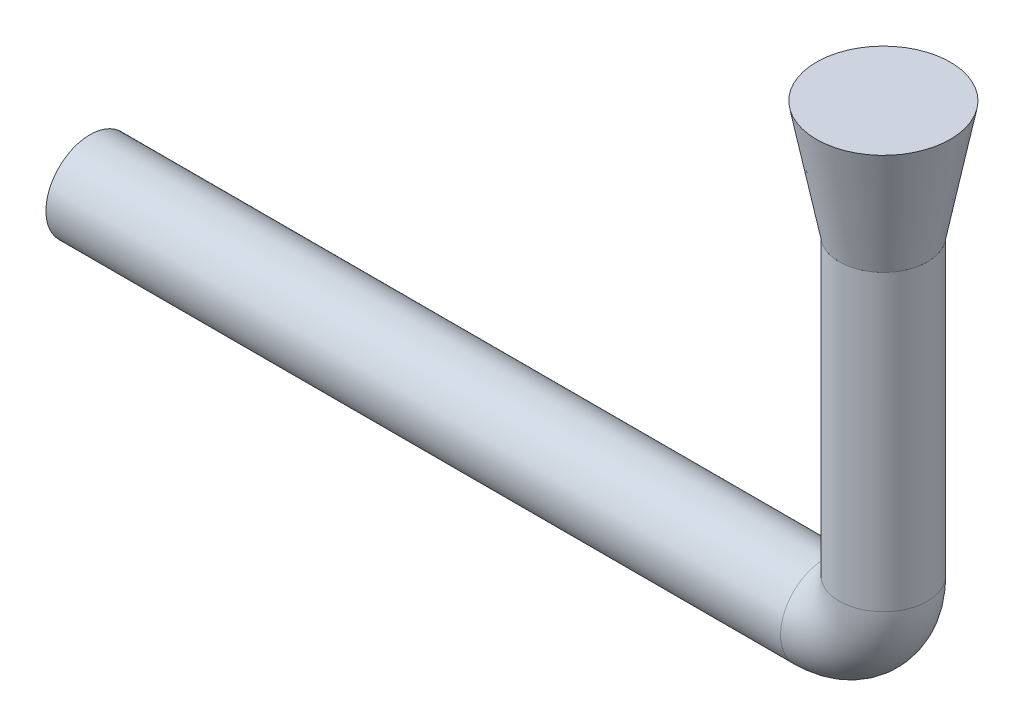
from build123d import *

# Parameters (mm, degrees)
SWEEP1_PROFILE_R    = 15
SKETCH30_R          = 15
BOSS_EXTRUDE1_DEPTH = 40
BOSS_EXTRUDE1_DRAFT = -11


with BuildPart() as part:
    # Sweep1: sweep along a path in Sketch1
    with BuildLine(Plane.XY) as sweep1_path:
        Line((0, 0), (250, 0))
        ThreePointArc((250, 0), (264.142135624, 5.857864376), (270, 20))
        Line((270, 20), (270, 120))
    # Sweep1 profile (on start of the path) → Sweep1 (sweep)
    with BuildSketch(Plane(origin=(0, 0, 0), x_dir=(0, 0, 1), z_dir=(1, 0, 0))):
        Circle(SWEEP1_PROFILE_R)
    sweep(path=sweep1_path.line)


with BuildPart() as body_2:
    # Sketch30 → Boss-Extrude1 (with draft: the straight prism first)
    with BuildSketch(Plane(origin=(0, 120, 0), x_dir=(1, 0, 0), z_dir=(0, 1, 0))):
        with Locations((270, 0)):
            Circle(SKETCH30_R)
    extrude(amount=BOSS_EXTRUDE1_DEPTH)
    # Boss-Extrude1: the draft: its side faces are tilted about the plane it starts from
    boss_extrude1_sides = [body_2.faces().sort_by_distance(p)[0] for p in [
        (255, 140, 0),
    ]]
    draft(boss_extrude1_sides, Plane(origin=(0, 120, 0), x_dir=(1, 0, 0), z_dir=(0, 1, 0)), BOSS_EXTRUDE1_DRAFT)


solid = Compound([part.part, body_2.part])
